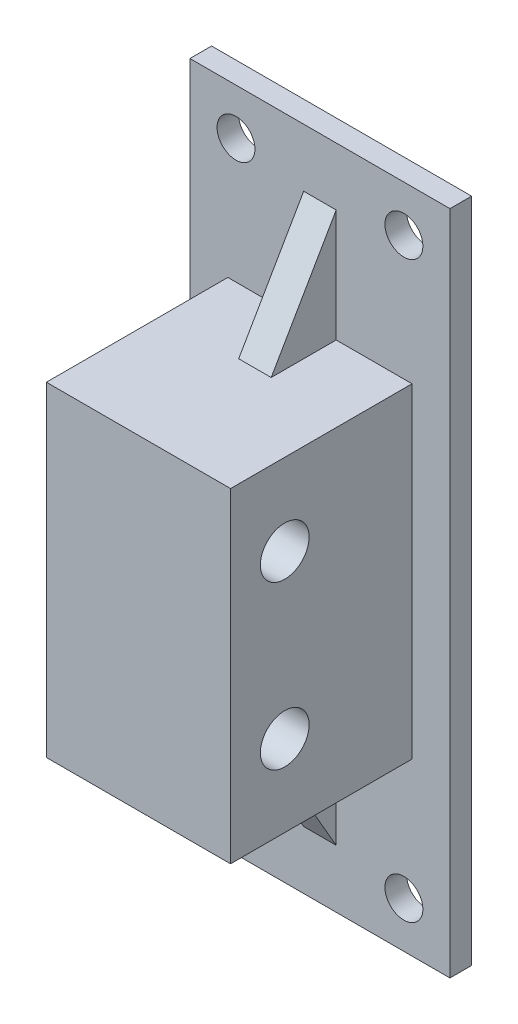
from build123d import *

# Parameters (mm, degrees)
SKETCH_2_W          = 24
SKETCH_2_H          = 61.5
SKETCH_2_R          = 1.75
EXTRUDE_1_DEPTH     = 2
SKETCH_3_W          = 17
SKETCH_3_H          = 30
EXTRUDE_2_DEPTH     = 16.75
SKETCH_4_R          = 2.25
CUT_EXTRUDE_1_DEPTH = 69.628073702
EXTRUDE_3_DEPTH     = 1.5
EXTRUDE_START       = -2
SKETCH_6_R          = 1.75
EXTRUDE_4_DEPTH     = 2
SKETCH_7_R          = 1.75
CUT_EXTRUDE_2_DEPTH = 69.108828356


with BuildPart() as part:
    # 草图2 → 凸台-拉伸1 (new body)
    with BuildSketch(Plane.XY):
        with Locations((12, 30.75)):
            Rectangle(SKETCH_2_W, SKETCH_2_H)
        with Locations((5, 56.5)):
            Circle(SKETCH_2_R, mode=Mode.SUBTRACT)
        with Locations((19, 56.5)):
            Circle(SKETCH_2_R, mode=Mode.SUBTRACT)
        with Locations((5, 5)):
            Circle(SKETCH_2_R, mode=Mode.SUBTRACT)
        with Locations((19, 5)):
            Circle(SKETCH_2_R, mode=Mode.SUBTRACT)
    extrude(amount=EXTRUDE_1_DEPTH)

    # 草图3 → 凸台-拉伸2 (add)
    with BuildSketch(Plane.XY.offset(2)):
        with Locations((12, 30.75)):
            Rectangle(SKETCH_3_W, SKETCH_3_H)
    extrude(amount=EXTRUDE_2_DEPTH)

    # 草图4 → 切除-拉伸1 (cut, through all)
    with BuildSketch(Plane(origin=(24, 0, 0), x_dir=(0, 0, -1), z_dir=(1, 0, 0))):
        with Locations(Location((-13.75, 23.25, 0), (0, 0, 270))):
            Circle(SKETCH_4_R)
        with Locations(Location((-13.75, 38.25, 0), (0, 0, 270))):
            Circle(SKETCH_4_R)
    extrude(amount=-CUT_EXTRUDE_1_DEPTH, mode=Mode.SUBTRACT)

    # 草图5 → 凸台-拉伸3 (add, symmetric)
    with BuildSketch(Plane(origin=(12, 0, 0), x_dir=(0, 0, -1), z_dir=(1, 0, 0))):
        Polygon((-2, 56.142304845), (-2, 45.75), (-8, 45.75), align=None)
        Polygon((-2, 15.75), (-2, 5.357695155), (-8, 15.75), align=None)
    extrude(amount=EXTRUDE_3_DEPTH, both=True)

    # 草图6 → 凸台-拉伸4 (add)
    with BuildSketch(Plane.XY.offset(2).offset(EXTRUDE_START)):
        with Locations((5, 56.5)):
            Circle(SKETCH_6_R)
        with Locations((19, 56.5)):
            Circle(SKETCH_6_R)
        with Locations((19, 5)):
            Circle(SKETCH_6_R)
        with Locations((5, 5)):
            Circle(SKETCH_6_R)
    extrude(amount=EXTRUDE_4_DEPTH)

    # 草图7 → 切除-拉伸2 (cut, through all)
    with BuildSketch(Plane.XY.offset(2)):
        with Locations((4.25, 57.25)):
            Circle(SKETCH_7_R)
        with Locations((19.75, 57.25)):
            Circle(SKETCH_7_R)
        with Locations((4.25, 4.25)):
            Circle(SKETCH_7_R)
        with Locations((19.75, 4.25)):
            Circle(SKETCH_7_R)
    extrude(amount=-CUT_EXTRUDE_2_DEPTH, mode=Mode.SUBTRACT)


solid = part.part
